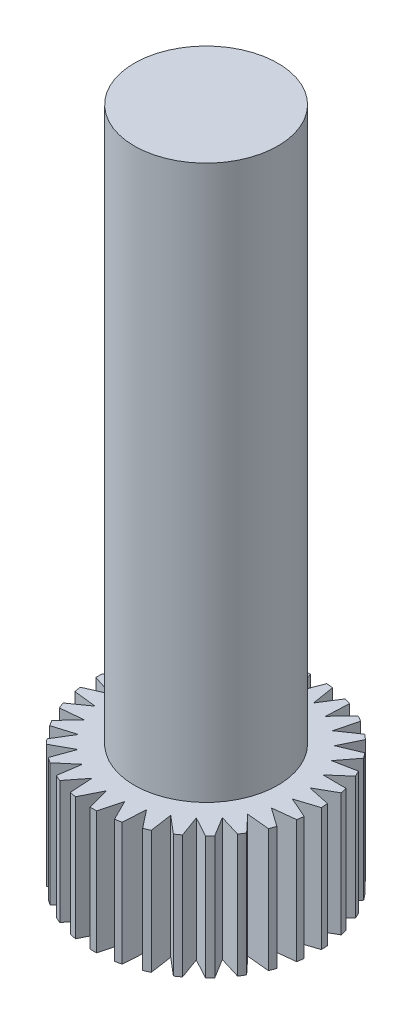
from build123d import *

# Parameters (mm, degrees)
SKETCH_1_R          = 5.5
EXTRUDE_1_DEPTH     = 6
CUT_EXTRUDE_4_DEPTH = 10.823441352
SKETCH_3_R          = 3.5
EXTRUDE_5_DEPTH     = 27


with BuildPart() as part:
    # Эскиз1 → Вытянуть1 (new body)
    with BuildSketch(Plane(origin=(0, 0, 0), x_dir=(1, 0, 0), z_dir=(0, 1, 0))):
        with Locations(Location((0, 0, 0), (0, 0, 270))):
            Circle(SKETCH_1_R)
    extrude(amount=EXTRUDE_1_DEPTH)

    # Эскиз2 → Вытянуть4 (cut, through all)
    with BuildSketch(Plane(origin=(0, 0, 0), x_dir=(1, 0, 0), z_dir=(0, 1, 0))):
        Polygon((-0.5, 5.758821463), (0.5, 5.758821463), (0, 4.437090717), align=None)
        Polygon((0.669477267, 5.741587309), (0.893179795, 4.346263209), (1.649007209, 5.540288789), align=None)
        Polygon((1.811546057, 5.489291897), (1.749792704, 4.077499175), (2.730503868, 5.094936042), align=None)
        Polygon((2.879449938, 5.012264229), (2.534768894, 3.641801846), (3.700213379, 4.440996014), align=None)
        Polygon((3.8294688, 4.330033874), (3.215971348, 3.057008721), (4.518435719, 3.605241087), align=None)
        Polygon((4.622708759, 3.470531425), (3.765511557, 2.3470613), (5.15167277, 2.621887167), align=None)
        Polygon((5.226694479, 2.46894501), (4.16089128, 1.541024913), (5.573999732, 1.531192878), align=None)
        Polygon((5.616698713, 1.366279697), (4.385923626, 0.671898786), (5.76812649, 0.377811373), align=None)
        Polygon((5.776754641, 0.207678733), (4.431395743, -0.224734957), (5.726105473, -0.791037774), align=None)
        Polygon((5.700309556, -0.959424623), (4.295445997, -1.112168024), (5.449657024, -1.927501742), align=None)
        Polygon((5.390493128, -2.087249022), (3.983640188, -1.954068802), (4.950098976, -2.985053562), align=None)
        Polygon((4.859989278, -3.129621201), (3.508743681, -2.715969773), (4.247883295, -3.920396938), align=None)
        Polygon((4.130516895, -4.043866321), (2.890198796, -3.366678623), (3.371758773, -4.695238804), align=None)
        Polygon((3.231940666, -4.792555078), (2.153328833, -3.879555254), (2.35759405, -5.27785704), align=None)
        Polygon((2.201048406, -5.345036067), (1.328301334, -4.233602437), (1.24690915, -5.64439919), align=None)
        Polygon((1.080044966, -5.678690651), (0.448893022, -4.414325439), (0.085175642, -5.779858973), align=None)
        Polygon((-0.085175642, -5.779858973), (-0.448893022, -4.414325439), (-1.080044966, -5.678690651), align=None)
        Polygon((-1.24690915, -5.64439919), (-1.328301334, -4.233602437), (-2.201048406, -5.345036067), align=None)
        Polygon((-2.35759405, -5.27785704), (-2.153328833, -3.879555254), (-3.231940666, -4.792555078), align=None)
        Polygon((-3.371758773, -4.695238804), (-2.890198796, -3.366678623), (-4.130516895, -4.043866321), align=None)
        Polygon((-4.247883295, -3.920396938), (-3.508743681, -2.715969773), (-4.859989278, -3.129621201), align=None)
        Polygon((-4.950098976, -2.985053562), (-3.983640188, -1.954068802), (-5.390493128, -2.087249022), align=None)
        Polygon((-5.449657024, -1.927501742), (-4.295445997, -1.112168024), (-5.700309556, -0.959424623), align=None)
        Polygon((-5.726105473, -0.791037774), (-4.431395743, -0.224734957), (-5.776754641, 0.207678733), align=None)
        Polygon((-5.76812649, 0.377811373), (-4.385923626, 0.671898786), (-5.616698713, 1.366279697), align=None)
        Polygon((-5.573999732, 1.531192878), (-4.16089128, 1.541024913), (-5.226694479, 2.46894501), align=None)
        Polygon((-5.15167277, 2.621887167), (-3.765511557, 2.3470613), (-4.622708759, 3.470531425), align=None)
        Polygon((-4.518435719, 3.605241087), (-3.215971348, 3.057008721), (-3.8294688, 4.330033874), align=None)
        Polygon((-3.700213379, 4.440996014), (-2.534768894, 3.641801846), (-2.879449938, 5.012264229), align=None)
        Polygon((-2.730503868, 5.094936042), (-1.749792704, 4.077499175), (-1.811546057, 5.489291897), align=None)
        Polygon((-1.649007209, 5.540288789), (-0.893179795, 4.346263209), (-0.669477267, 5.741587309), align=None)
    extrude(amount=CUT_EXTRUDE_4_DEPTH, mode=Mode.SUBTRACT)

    # Эскиз3 → Вытянуть5 (add)
    with BuildSketch(Plane(origin=(0, 6, 0), x_dir=(-1, 0, 0), z_dir=(0, 1, 0))):
        with Locations(Location((0, 0, 0), (0, 0, 90))):
            Circle(SKETCH_3_R)
    extrude(amount=EXTRUDE_5_DEPTH)


solid = part.part
